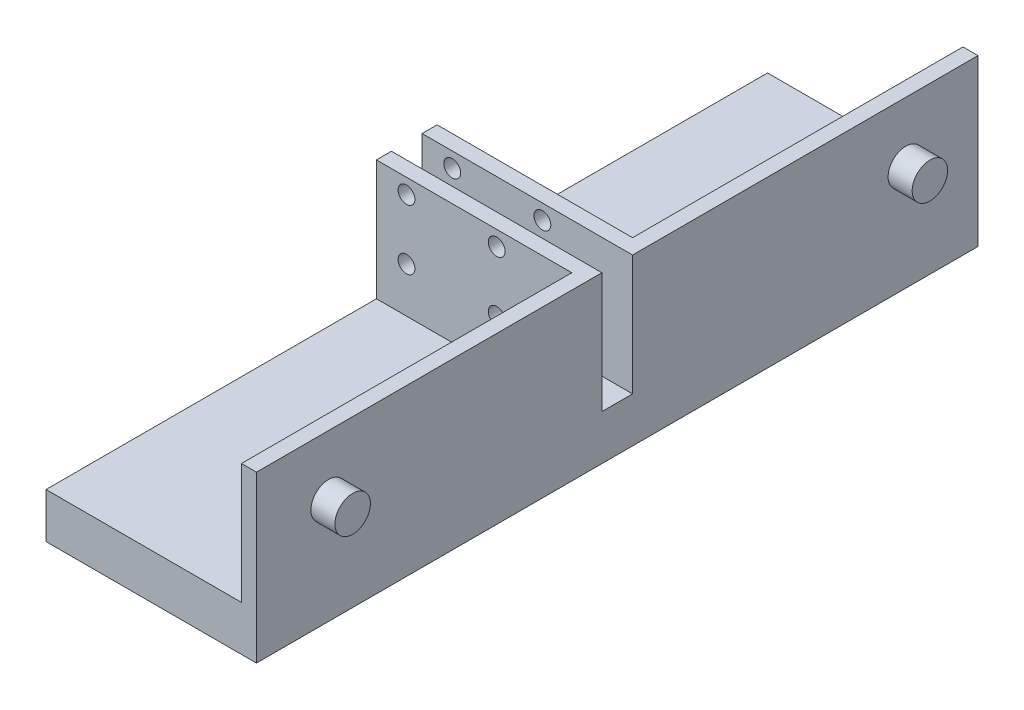
from build123d import *

# Parameters (mm, degrees)
SKETCH1_W           = 35
SKETCH1_H           = 120
BOSS_EXTRUDE1_DEPTH = 7.5
SKETCH2_W           = 32.5
SKETCH2_H           = 2.5
BOSS_EXTRUDE2_DEPTH = 20
SKETCH3_R           = 1.4
CUT_EXTRUDE1_DEPTH  = 12
SKETCH4_R           = 2.95
BOSS_EXTRUDE3_DEPTH = 4


with BuildPart() as part:
    # Sketch1 → Boss-Extrude1 (new body)
    with BuildSketch(Plane(origin=(0, 0, 0), x_dir=(1, 0, 0), z_dir=(0, 1, 0))):
        with Locations((17.5, 0)):
            Rectangle(SKETCH1_W, SKETCH1_H)
    extrude(amount=BOSS_EXTRUDE1_DEPTH)

    # Sketch2 → Boss-Extrude2 (add)
    with BuildSketch(Plane(origin=(0, 7.5, 0), x_dir=(1, 0, 0), z_dir=(0, 1, 0))):
        Polygon((35, 2.55), (35, 60), (32.5, 60), (32.5, 5.05), (32.5, 2.55), align=None)
        with Locations((16.25, 3.8)):
            Rectangle(SKETCH2_W, SKETCH2_H)
        with Locations((16.25, -3.8)):
            Rectangle(SKETCH2_W, SKETCH2_H)
        Polygon((35, -60), (35, -2.55), (32.5, -2.55), (32.5, -5.05), (32.5, -60), align=None)
    extrude(amount=BOSS_EXTRUDE2_DEPTH)

    # Sketch3 → Cut-Extrude1 (cut)
    with BuildSketch(Plane.XY.offset(5.05)):
        with Locations((5, 25)):
            Circle(SKETCH3_R)
        with Locations((5, 15)):
            Circle(SKETCH3_R)
        with Locations((20, 25)):
            Circle(SKETCH3_R)
        with Locations((20, 15)):
            Circle(SKETCH3_R)
    extrude(amount=-CUT_EXTRUDE1_DEPTH, mode=Mode.SUBTRACT)

    # Sketch4 → Boss-Extrude3 (add)
    with BuildSketch(Plane(origin=(35, 0, 0), x_dir=(0, 0, -1), z_dir=(1, 0, 0))):
        with Locations(Location((-48, 17.5, 0), (0, 0, 180))):
            Circle(SKETCH4_R)
        with Locations(Location((48, 17.5, 0), (0, 0, 180))):
            Circle(SKETCH4_R)
    extrude(amount=BOSS_EXTRUDE3_DEPTH)


solid = part.part
